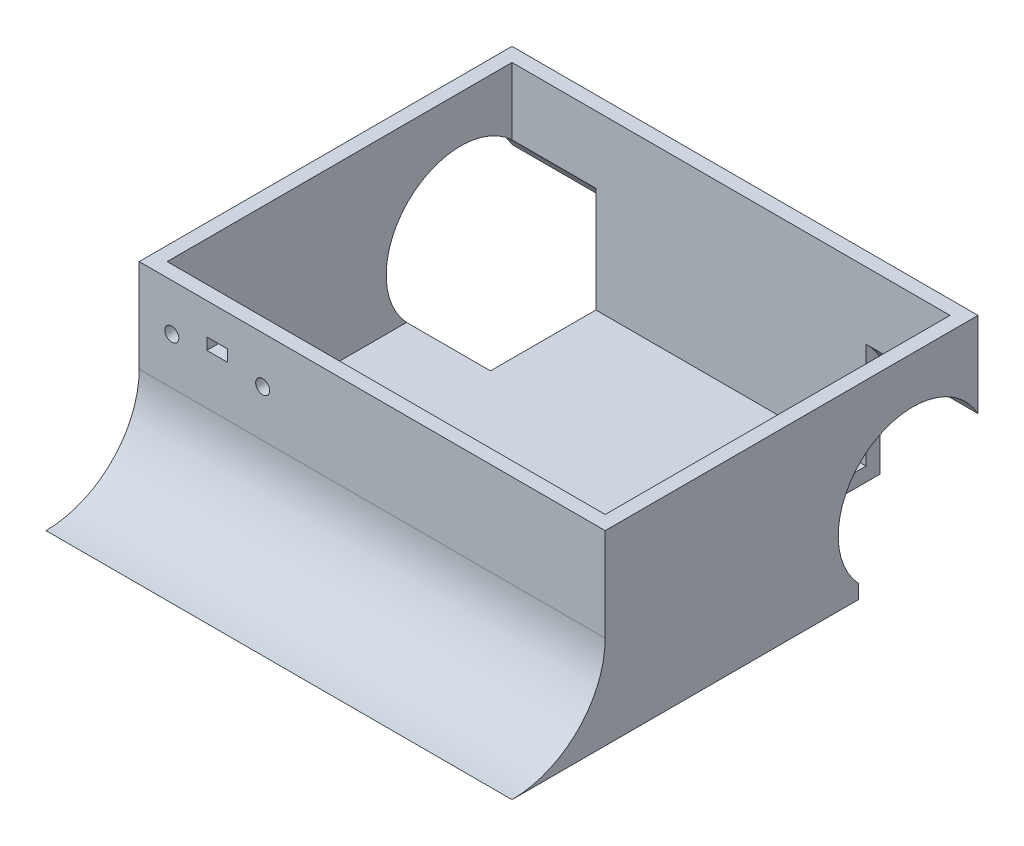
from build123d import *

# Parameters (mm, degrees)
ESBO_O1_W                  = 100
ESBO_O1_H                  = 100
RESSALTO_EXTRUS_O1_DEPTH   = 20
CORTE_EXTRUS_O1_DEPTH      = 74.484692283
CORTE_EXTRUS_O1_DEPTH_BACK = 74.484692283
ESBO_O2_R                  = 20
ESBO_O3_W                  = 94
ESBO_O3_H                  = 74
CORTE_EXTRUS_O2_DEPTH      = 74.484692283
ESBO_O5_W                  = 94
ESBO_O5_H                  = 74
CORTE_EXTRUS_O3_DEPTH      = 17
CORTE_EXTRUS_O4_START      = 50
ESBO_O6_R                  = 16
CORTE_EXTRUS_O4_DEPTH      = 21
CORTE_EXTRUS_O5_START      = -29
ESBO_O6_4_R                = 16
CORTE_EXTRUS_O5_DEPTH      = 21
ESBO_O7_W                  = 21
ESBO_O7_H                  = 3.872983347
CORTE_EXTRUS_O6_DEPTH      = 21
ESBO_O8_R                  = 1.5
ESBO_O8_W                  = 4.5
ESBO_O8_H                  = 2.5
CORTE_EXTRUS_O8_DEPTH      = 74.484692283


with BuildPart() as part:
    # Esboço1 → Ressalto-extrusão1 (new, symmetric)
    with BuildSketch(Plane(origin=(0, 0, 0), x_dir=(1, 0, 0), z_dir=(0, 1, 0))):
        Rectangle(ESBO_O1_W, ESBO_O1_H)
    extrude(amount=RESSALTO_EXTRUS_O1_DEPTH, both=True)

    # Esboço2 → Corte-extrusão1 (cut, two sides: drawn at the far end of the back side and taken through both)
    with BuildSketch(Plane(origin=(0, 0, 0), x_dir=(0, 0, -1), z_dir=(1, 0, 0)).offset(-CORTE_EXTRUS_O1_DEPTH_BACK)):
        with BuildLine():
            Line((-30, 20), (-50, 20))
            ThreePointArc((-50, 20), (-35.857864376, 14.142135624), (-30, 0))
            Line((-30, 0), (-30, 20))
        make_face()
        with Locations((-50, 0)):
            Circle(ESBO_O2_R)
    extrude(amount=CORTE_EXTRUS_O1_DEPTH + CORTE_EXTRUS_O1_DEPTH_BACK, mode=Mode.SUBTRACT)

    # Esboço3 → Corte-extrusão2 (cut, through all)
    with BuildSketch(Plane(origin=(0, 0, 0), x_dir=(1, 0, 0), z_dir=(0, 1, 0))):
        with Locations((0, 10)):
            Rectangle(ESBO_O3_W, ESBO_O3_H)
    extrude(amount=CORTE_EXTRUS_O2_DEPTH, mode=Mode.SUBTRACT)

    # Esboço5 → Corte-extrusão3 (cut)
    with BuildSketch(Plane(origin=(0, 0, 0), x_dir=(1, 0, 0), z_dir=(0, 1, 0))):
        with Locations((0, 10)):
            Rectangle(ESBO_O5_W, ESBO_O5_H)
    extrude(amount=-CORTE_EXTRUS_O3_DEPTH, mode=Mode.SUBTRACT)

    # Esboço6 → Corte-extrusão4 (cut)
    with BuildSketch(Plane(origin=(0, 0, 0), x_dir=(0, 0, -1), z_dir=(1, 0, 0)).offset(CORTE_EXTRUS_O4_START)):
        with Locations((36, -6)):
            Circle(ESBO_O6_R)
        with BuildLine():
            ThreePointArc((52, -6), (47.313708499, -17.313708499), (36, -22))
            Line((36, -22), (52, -22))
            Line((52, -22), (52, -6))
        make_face()
    extrude(amount=-CORTE_EXTRUS_O4_DEPTH, mode=Mode.SUBTRACT)

    # Esboço6<4> → Corte-extrusão5 (cut)
    with BuildSketch(Plane(origin=(0, 0, 0), x_dir=(0, 0, -1), z_dir=(1, 0, 0)).offset(CORTE_EXTRUS_O5_START)):
        with BuildLine():
            ThreePointArc((52, -6), (47.313708499, -17.313708499), (36, -22))
            Line((36, -22), (52, -22))
            Line((52, -22), (52, -6))
        make_face()
        with Locations((36, -6)):
            Circle(ESBO_O6_4_R)
    extrude(amount=-CORTE_EXTRUS_O5_DEPTH, mode=Mode.SUBTRACT)

    # Esboço7 → Corte-extrusão6 (cut)
    with BuildSketch(Plane(origin=(0, 0, 0), x_dir=(1, 0, 0), z_dir=(0, 1, 0))):
        with Locations((-39.5, 26.317541635)):
            Rectangle(ESBO_O7_W, ESBO_O7_H)
        with Locations((39.5, 26.317541635)):
            Rectangle(ESBO_O7_W, ESBO_O7_H)
    extrude(amount=-CORTE_EXTRUS_O6_DEPTH, mode=Mode.SUBTRACT)

    # Esboço8 → Corte-extrusão8 (cut, through all)
    with BuildSketch(Plane.XY):
        with Locations(Location((-43, 10, 0), (0, 0, 180))):
            Circle(ESBO_O8_R)
        with Locations(Location((-23.5, 10, 0), (0, 0, 180))):
            Circle(ESBO_O8_R)
        with Locations((-33.25, 12)):
            Rectangle(ESBO_O8_W, ESBO_O8_H)
    extrude(amount=CORTE_EXTRUS_O8_DEPTH, mode=Mode.SUBTRACT)


solid = part.part
